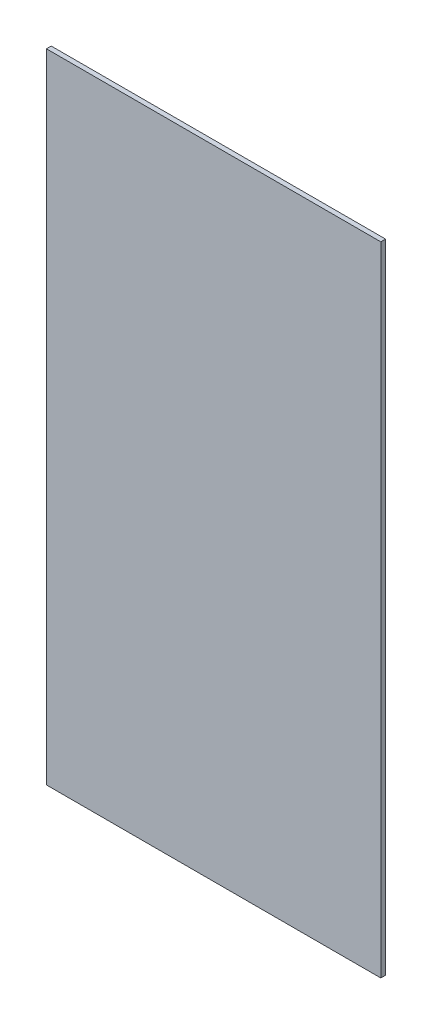
from build123d import *

# Parameters (mm, degrees)
SKETCH_1_W      = 279.576527547
SKETCH_1_H      = 4
EXTRUDE_1_DEPTH = 533


with BuildPart() as part:
    # Эскиз1 → Вытянуть1 (new body)
    with BuildSketch(Plane(origin=(0, 0, 0), x_dir=(1, 0, 0), z_dir=(0, 1, 0))):
        with Locations((-4.999950783, -4.341392103)):
            Rectangle(SKETCH_1_W, SKETCH_1_H)
    extrude(amount=EXTRUDE_1_DEPTH)


solid = part.part
